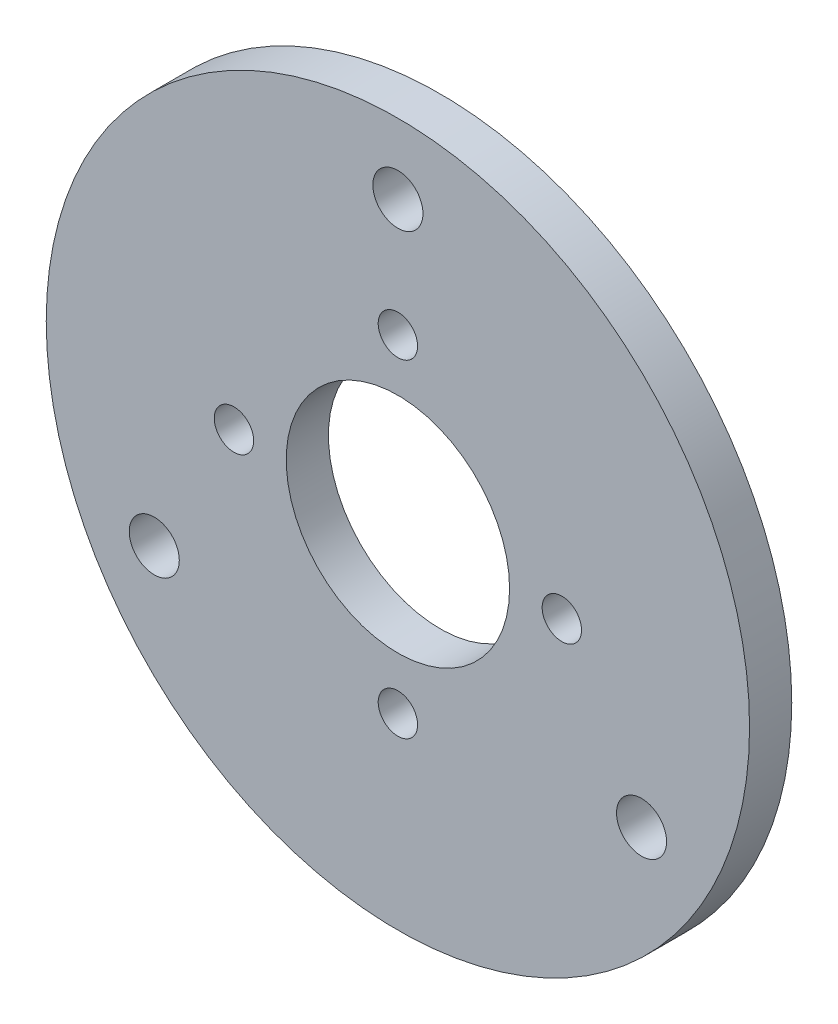
from build123d import *

# Parameters (mm, degrees)
SKETCH1_R                    = 15.875
SKETCH1_R_2                  = 3.96875
BOSS_EXTRUDE1_DEPTH          = 1.905
X_0_397_DIAMETER_HOLE1_D     = 10.0838
X_0_397_DIAMETER_HOLE1_DEPTH = 12.7
X_0_397_DIAMETER_HOLE1_TIP   = 3.029479155
CIRPATTERN1_COUNT            = 3
CIRPATTERN2_COUNT            = 4


with BuildPart() as part:
    # Sketch1 → Boss-Extrude1 (new body)
    with BuildSketch(Plane.XY):
        with Locations(Location((0, 0, 0), (0, 0, 180))):
            Circle(SKETCH1_R)
        with Locations(Location((0, 0, 0), (0, 0, 180))):
            Circle(SKETCH1_R_2, mode=Mode.SUBTRACT)
    extrude(amount=BOSS_EXTRUDE1_DEPTH)

    # X (0.397) Diameter Hole1
    with Locations(Plane.XY.offset(1.905)):
        with Locations((0, 0)):
            Hole(X_0_397_DIAMETER_HOLE1_D / 2, depth=X_0_397_DIAMETER_HOLE1_DEPTH)
            with Locations((0, 0, -(X_0_397_DIAMETER_HOLE1_DEPTH + X_0_397_DIAMETER_HOLE1_TIP / 2))):  # 118° drill point
                Cone(0, X_0_397_DIAMETER_HOLE1_D / 2, X_0_397_DIAMETER_HOLE1_TIP, mode=Mode.SUBTRACT)

    # Sketch4 → #4-40 Tapped Hole1 (revolve, cut)
    with BuildSketch(Plane(origin=(0, 12.7, 1.905), x_dir=(0, -1, 0), z_dir=(1, 0, 0))):
        Polygon((0, 0), (0, 9.543752758), (1.1303, 8.8646), (1.1303, 0), align=None)
    f_4_40_tapped_hole1 = revolve(axis=Axis((0, 12.7, 8.255), (0, 0, -1)), mode=Mode.SUBTRACT)

    # CirPattern1: #4-40 Tapped Hole1 ×3 about axis
    cirpattern1_axis = Axis((0, 0, 0), (0, 0, 1))
    for i in range(1, CIRPATTERN1_COUNT):
        add(f_4_40_tapped_hole1.rotate(cirpattern1_axis, i * 360 / CIRPATTERN1_COUNT), mode=Mode.SUBTRACT)

    # Sketch6 → #2-56 Tapped Hole1 (revolve, cut)
    with BuildSketch(Plane(origin=(0, 7.4, 1.905), x_dir=(0, -1, 0), z_dir=(1, 0, 0))):
        Polygon((0, 0), (0, 7.18896509), (0.889, 6.6548), (0.889, 0), align=None)
    f_2_56_tapped_hole1 = revolve(axis=Axis((0, 7.4, 8.255), (0, 0, -1)), mode=Mode.SUBTRACT)

    # CirPattern2: #2-56 Tapped Hole1 ×4 about axis
    cirpattern2_axis = Axis((0, 0, 0), (0, 0, 1))
    for i in range(1, CIRPATTERN2_COUNT):
        add(f_2_56_tapped_hole1.rotate(cirpattern2_axis, i * 360 / CIRPATTERN2_COUNT), mode=Mode.SUBTRACT)


solid = part.part
